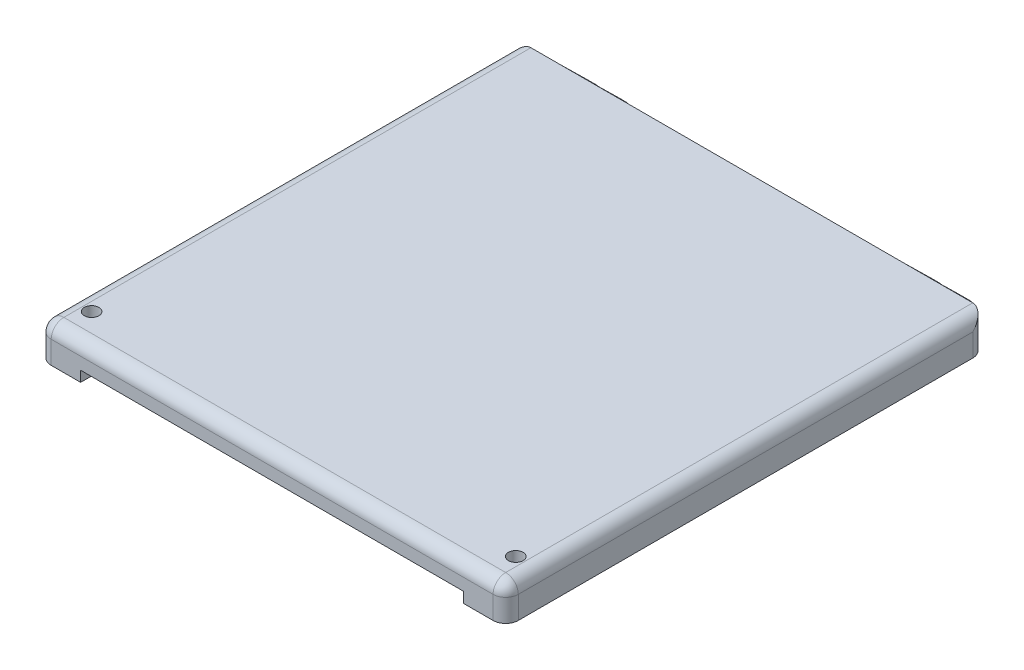
from build123d import *

# Parameters (mm, degrees)
SKETCH1_W               = 140.97
SKETCH1_H               = 144.78
BOSS_EXTRUDE1_DEPTH     = 5.08
SKETCH2_W               = 140.97
SKETCH2_H               = 144.78
SKETCH2_W_2             = 115.57
SKETCH2_H_2             = 12.7
SKETCH2_W_3             = 130.81
SKETCH2_H_3             = 120.65
BOSS_EXTRUDE2_DEPTH     = 5.55625
SKETCH3_W               = 115.57
SKETCH3_H               = 19.05
CUT_EXTRUDE1_DEPTH      = 3.175
SKETCH4_R               = 2.2
BOSS_EXTRUDE3_DEPTH     = 3
MIRROR2_COPY_1_SKETCH_R = 2.2
MIRROR2_COPY_1_DEPTH    = 3
SKETCH5_R               = 2.2
CUT_EXTRUDE2_DEPTH      = 109.755169743
SKETCH6_R               = 4.572
CUT_EXTRUDE3_DEPTH      = 2.54
FILLET1_R               = 3.81


with BuildPart() as part:
    # Sketch1 → Boss-Extrude1 (new body)
    with BuildSketch(Plane(origin=(0, 0, 0), x_dir=(1, 0, 0), z_dir=(0, 1, 0))):
        Rectangle(SKETCH1_W, SKETCH1_H)
    extrude(amount=BOSS_EXTRUDE1_DEPTH)

    # Sketch2 → Boss-Extrude2 (add)
    with BuildSketch(Plane.XZ):
        Rectangle(SKETCH2_W, SKETCH2_H)
        with Locations((0, 62.865)):
            Rectangle(SKETCH2_W_2, SKETCH2_H_2, mode=Mode.SUBTRACT)
        with Locations((0, -6.985)):
            Rectangle(SKETCH2_W_3, SKETCH2_H_3, mode=Mode.SUBTRACT)
    extrude(amount=BOSS_EXTRUDE2_DEPTH)

    # Sketch3 → Cut-Extrude1 (cut)
    with BuildSketch(Plane.XZ.offset(5.55625)):
        with Locations((0, 62.865)):
            Rectangle(SKETCH3_W, SKETCH3_H)
    extrude(amount=-CUT_EXTRUDE1_DEPTH, mode=Mode.SUBTRACT)

    # Sketch4 → Boss-Extrude3 (add)
    with BuildSketch(Plane(origin=(57.785, 0, 0), x_dir=(0, 0, -1), z_dir=(1, 0, 0))):
        with BuildLine():
            Line((72.39, 5.08), (80.298586194, -2.669654518))
            ThreePointArc((80.298586194, -2.669654518), (80.144596616, -8.586079413), (74.254776903, -8.004856495))
            Line((74.254776903, -8.004856495), (72.39, -5.55625))
            Line((72.39, -5.55625), (72.39, 5.08))
        make_face()
        with Locations((77.47, -5.55625)):
            Circle(SKETCH4_R, mode=Mode.SUBTRACT)
    boss_extrude3 = extrude(amount=-BOSS_EXTRUDE3_DEPTH)

    # Mirror1: Boss-Extrude3 across plane
    add(boss_extrude3.mirror(Plane.ZY.offset(-51.784999904)))

    # Mirror2: Boss-Extrude3 across plane
    add(boss_extrude3.mirror(Plane(origin=(0, 0, 0), x_dir=(0, 0, 1), z_dir=(1, 0, 0))))

    # Mirror2 copy 1 sketch → Mirror2 copy 1 (add)
    with BuildSketch(Plane(origin=(-45.784999808, 0, 0), x_dir=(0, 0, -1), z_dir=(1, 0, 0))):
        with BuildLine():
            Line((72.39, 5.08), (80.298586194, -2.669654518))
            ThreePointArc((80.298586194, -2.669654518), (80.144596616, -8.586079413), (74.254776903, -8.004856495))
            Line((74.254776903, -8.004856495), (72.39, -5.55625))
            Line((72.39, -5.55625), (72.39, 5.08))
        make_face()
        with Locations((77.47, -5.55625)):
            Circle(MIRROR2_COPY_1_SKETCH_R, mode=Mode.SUBTRACT)
    extrude(amount=-MIRROR2_COPY_1_DEPTH)

    # Sketch5 → Cut-Extrude2 (cut, through all)
    with BuildSketch(Plane(origin=(0, 5.08, 0), x_dir=(1, 0, 0), z_dir=(0, 1, 0))):
        with Locations(Location((64.008, -62.865, 0), (0, 0, 270))):
            Circle(SKETCH5_R)
        with Locations(Location((-64.008, -62.865, 0), (0, 0, 270))):
            Circle(SKETCH5_R)
    extrude(amount=-CUT_EXTRUDE2_DEPTH, mode=Mode.SUBTRACT)

    # Sketch6 → Cut-Extrude3 (cut)
    with BuildSketch(Plane.XZ.offset(5.55625)):
        with Locations(Location((-64.008, 62.865, 0), (0, 0, 270))):
            Circle(SKETCH6_R)
        with Locations(Location((64.008, 62.865, 0), (0, 0, 270))):
            Circle(SKETCH6_R)
    extrude(amount=-CUT_EXTRUDE3_DEPTH, mode=Mode.SUBTRACT)

    # Fillet1
    fillet1_edges = [part.edges().sort_by_distance(p)[0] for p in [
        (-70.485, 5.08, 0),
        (0, 5.08, 72.39),
        (70.485, 5.08, 0),
        (70.485, -0.238125, 72.39),
        (-70.485, -0.238125, 72.39),
        (-70.485, -0.238125, -72.39),
        (70.485, -0.238125, -72.39),
    ]]
    fillet(fillet1_edges, radius=FILLET1_R)


solid = part.part
